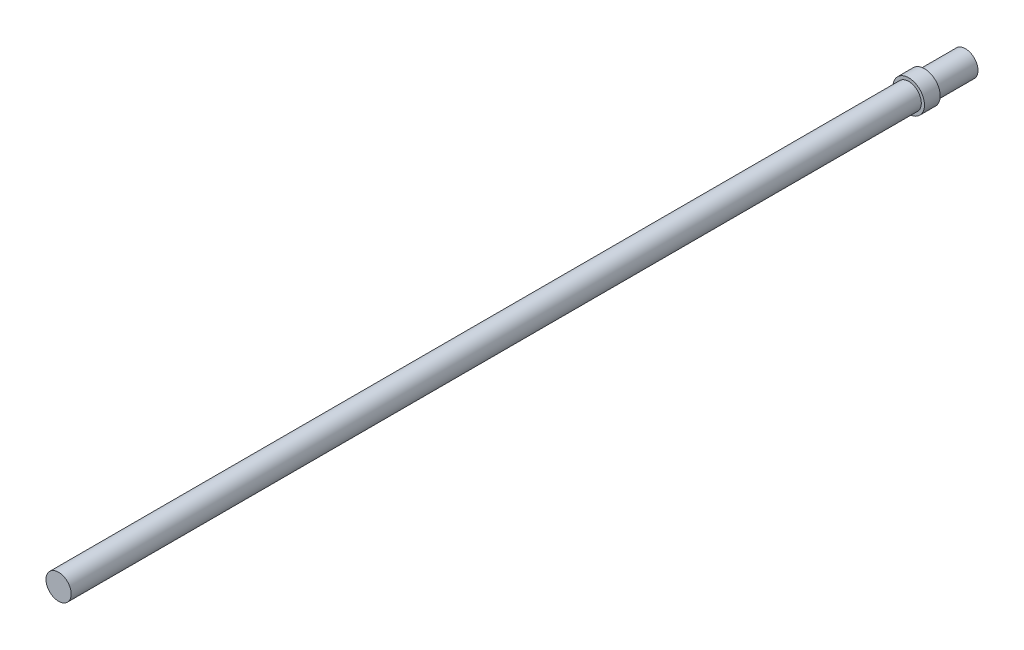
from build123d import *

# Parameters (mm, degrees)
SKETCH1_R           = 4
BOSS_EXTRUDE1_DEPTH = 270
SKETCH2_R           = 5
BOSS_EXTRUDE2_DEPTH = 5
BOSS_EXTRUDE3_START = -18
SKETCH3_R           = 4
BOSS_EXTRUDE3_DEPTH = 18


with BuildPart() as part:
    # Sketch1 → Boss-Extrude1 (new body)
    with BuildSketch(Plane.XY):
        Circle(SKETCH1_R)
    extrude(amount=BOSS_EXTRUDE1_DEPTH)

    # Sketch2 → Boss-Extrude2 (add)
    with BuildSketch(Plane.XY):
        Circle(SKETCH2_R)
    extrude(amount=-BOSS_EXTRUDE2_DEPTH)

    # Sketch3 → Boss-Extrude3 (add)
    with BuildSketch(Plane.XY.offset(BOSS_EXTRUDE3_START)):
        Circle(SKETCH3_R)
    extrude(amount=BOSS_EXTRUDE3_DEPTH)


solid = part.part
